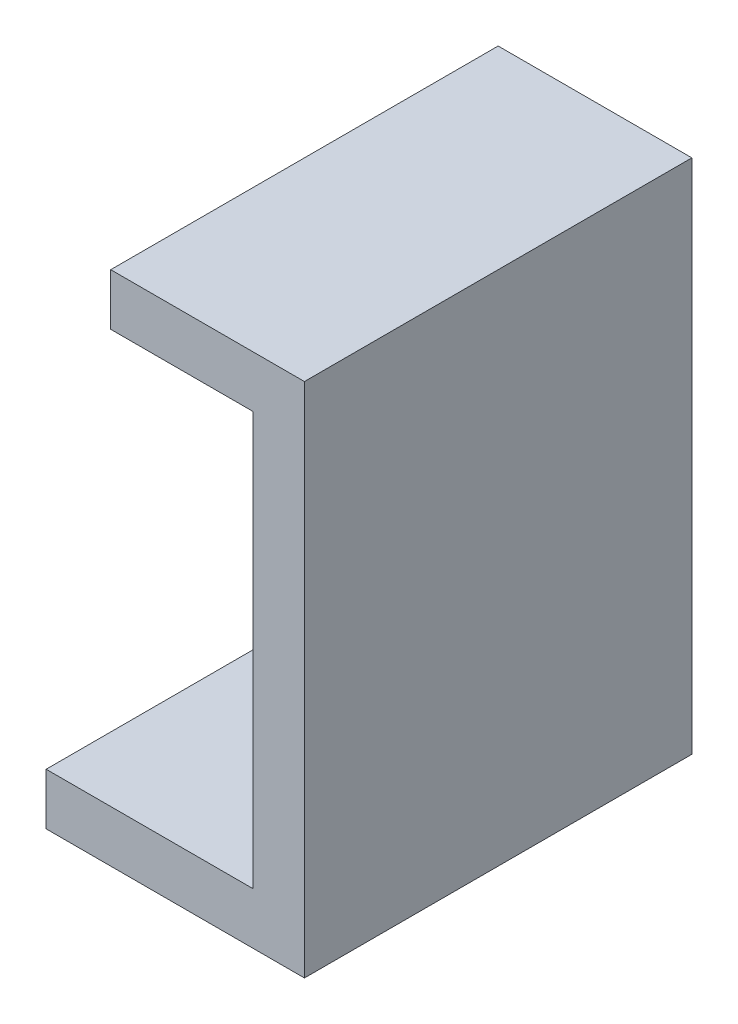
from build123d import *

# Parameters (mm, degrees)
BOSS_EXTRUDE1_DEPTH = 38.1


with BuildPart() as part:
    # Sketch1 → Boss-Extrude1 (new body)
    with BuildSketch(Plane.XY):
        Polygon((-21.233992122, 34.887308639), (-21.233992122, 29.807308639), (-7.263992122, 29.807308639), (-7.263992122, -10.832691361), (-27.583992122, -10.832691361), (-27.583992122, -15.912691361), (-2.183992122, -15.912691361), (-2.183992122, 34.887308639), align=None)
    extrude(amount=BOSS_EXTRUDE1_DEPTH)


solid = part.part
